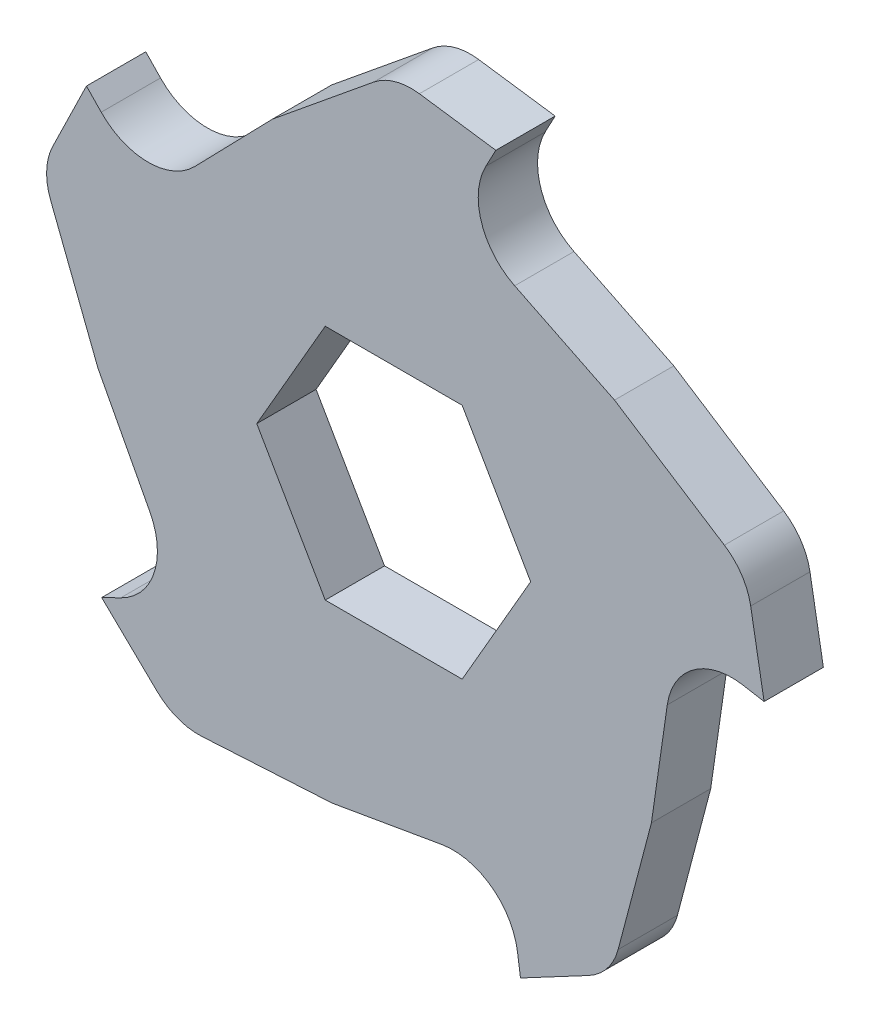
from build123d import *

# Parameters (mm, degrees)
SKETCH1_R           = 125
BOSS_EXTRUDE1_DEPTH = 20
CUT_EXTRUDE1_START  = -30
CUT_EXTRUDE1_DEPTH  = 30


with BuildPart() as part:
    # Sketch1 → Boss-Extrude1 (new body)
    with BuildSketch(Plane.XY):
        Circle(SKETCH1_R)
        Polygon((23.094010768, -40), (46.188021535, 0), (23.094010768, 40), (-23.094010768, 40), (-46.188021535, 0), (-23.094010768, -40), align=None, mode=Mode.SUBTRACT)
    extrude(amount=BOSS_EXTRUDE1_DEPTH)

    # Sketch3 → Cut-Extrude1 (cut)
    with BuildSketch(Plane.XY.offset(20).offset(CUT_EXTRUDE1_START)):
        with BuildLine():
            ThreePointArc((-6.774110793, 119.467271802), (0.492536101, 123.239201876), (8.661716474, 123.783357737))
            Line((8.661716474, 123.783357737), (34.45, 120.159050845))
            ThreePointArc((34.45, 120.159050845), (-42.75708256, 117.459916103), (-103.632412842, 69.895085725))
            Line((-103.632412842, 69.895085725), (-98.652289989, 64.738017545))
            ThreePointArc((-98.652289989, 64.738017545), (-82.862560201, 58.020530735), (-67.051084533, 64.686671523))
            Line((-67.051084533, 64.686671523), (-40.898801445, 91.592627068))
            Line((-40.898801445, 91.592627068), (-6.774110793, 119.467271802))
        make_face()
        with BuildLine():
            ThreePointArc((124.923683754, 4.367291753), (98.498353472, 76.96151222), (34.45, 120.159050845))
            Line((34.45, 120.159050845), (31.084279298, 113.829050845))
            ThreePointArc((31.084279298, 113.829050845), (29.574864535, 96.736307856), (40.800755858, 83.75865168))
            Line((40.800755858, 83.75865168), (74.471340122, 67.200749946))
            Line((74.471340122, 67.200749946), (111.526811975, 43.35997947))
            ThreePointArc((111.526811975, 43.35997947), (117.359648033, 37.614578084), (120.401586576, 30.013379267))
            Line((120.401586576, 30.013379267), (124.923683754, 4.367291753))
        make_face()
        with BuildLine():
            ThreePointArc((42.75708256, -117.459916103), (103.632412842, -69.895085725), (124.923683754, 4.367291753))
            Line((124.923683754, 4.367291753), (117.863431111, 5.612204784))
            ThreePointArc((117.863431111, 5.612204784), (101.140831696, 1.765795466), (92.26733842, -12.920977933))
            Line((92.26733842, -12.920977933), (86.924620828, -50.060279532))
            Line((86.924620828, -50.060279532), (75.70147125, -92.669330738))
            ThreePointArc((75.70147125, -92.669330738), (72.039715291, -99.992114147), (65.75055633, -105.234069233))
            Line((65.75055633, -105.234069233), (42.75708256, -117.459916103))
        make_face()
        with BuildLine():
            Line((-115.048351394, 46.488943056), (-103.632412842, 69.895085725))
            ThreePointArc((-103.632412842, 69.895085725), (-124.923683754, -4.367291753), (-98.498353472, -76.96151222))
            Line((-98.498353472, -76.96151222), (-92.054747579, -73.818755638))
            ThreePointArc((-92.054747579, -73.818755638), (-80.786743134, -60.877647816), (-82.240605082, -43.780090059))
            Line((-82.240605082, -43.780090059), (-99.748189513, -10.593393299))
            Line((-99.748189513, -10.593393299), (-115.713442688, 30.474855047))
            ThreePointArc((-115.713442688, 30.474855047), (-117.055243981, 38.551437421), (-115.048351394, 46.488943056))
        make_face()
        with BuildLine():
            Line((-79.765507985, -95.051610828), (-98.498353472, -76.96151222))
            ThreePointArc((-98.498353472, -76.96151222), (-34.45, -120.159050845), (42.75708256, -117.459916103))
            Line((42.75708256, -117.459916103), (41.75932716, -110.360517537))
            ThreePointArc((41.75932716, -110.360517537), (32.933607104, -95.644986241), (16.223595337, -91.744255211))
            Line((16.223595337, -91.744255211), (-20.748969991, -98.139704183))
            Line((-20.748969991, -98.139704183), (-64.740729744, -100.632775581))
            ThreePointArc((-64.740729744, -100.632775581), (-72.836655443, -99.413103234), (-79.765507985, -95.051610828))
        make_face()
    extrude(amount=CUT_EXTRUDE1_DEPTH, mode=Mode.SUBTRACT)


solid = part.part
